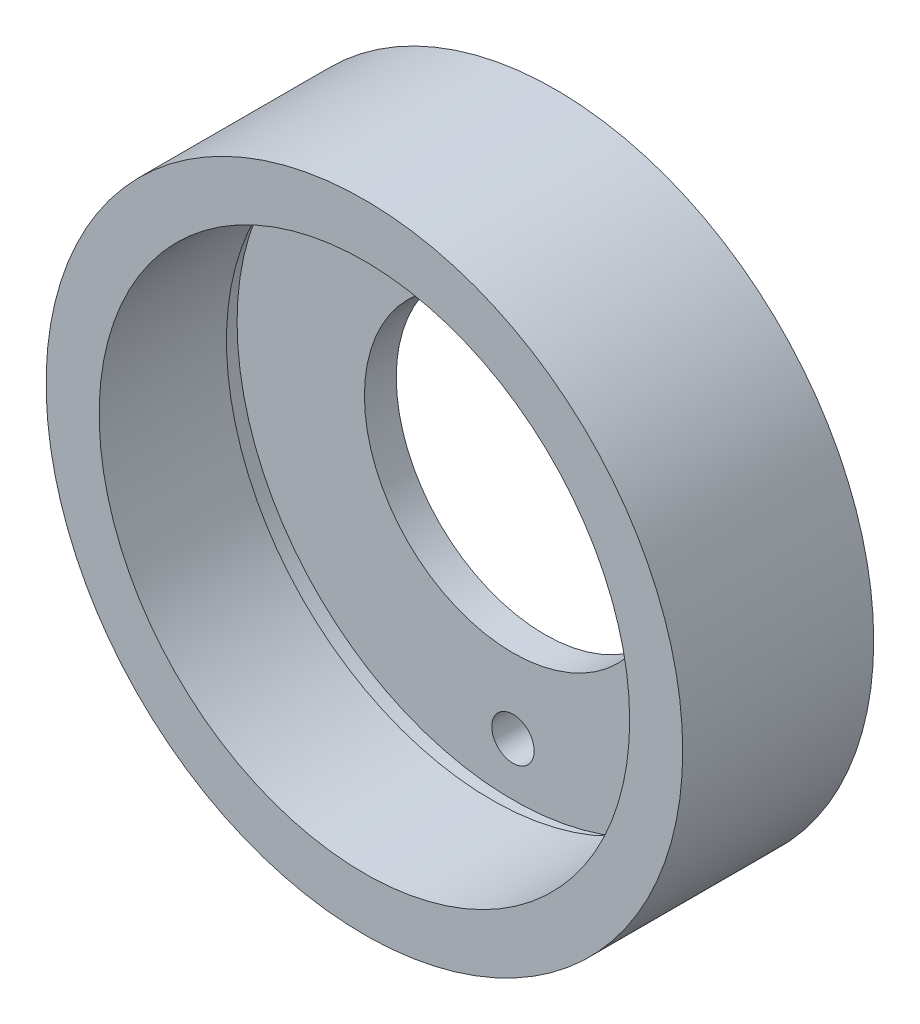
from build123d import *

# Parameters (mm, degrees)
ESQUISSE1_R                             = 15
BOSS_EXTRU_1_DEPTH                      = 2
ESQUISSE2_R                             = 15
ESQUISSE2_R_2                           = 13
BOSS_EXTRU_2_DEPTH                      = 1
ESQUISSE3_R                             = 15
ESQUISSE3_R_2                           = 12.5
BOSS_EXTRU_3_DEPTH                      = 6
ESQUISSE5_R                             = 8.5
ENL_V_MAT_EXTRU_1_DEPTH                 = 0.5
ESQUISSE6_R                             = 7
ENL_V_MAT_EXTRU_2_DEPTH                 = 1.5
DIAM_TRE_DU_PER_AGE_2_0_2_1_D           = 2
DIAM_TRE_DU_PER_AGE_2_0_2_1_CSINK_D     = 2.05
DIAM_TRE_DU_PER_AGE_2_0_2_1_CSINK_ANGLE = 90


with BuildPart() as part:
    # Esquisse1 → Boss.-Extru.1 (new body)
    with BuildSketch(Plane.XY):
        Circle(ESQUISSE1_R)
    extrude(amount=BOSS_EXTRU_1_DEPTH)

    # Esquisse2 → Boss.-Extru.2 (add)
    with BuildSketch(Plane.XY.offset(2)):
        Circle(ESQUISSE2_R)
        Circle(ESQUISSE2_R_2, mode=Mode.SUBTRACT)
    extrude(amount=BOSS_EXTRU_2_DEPTH)

    # Esquisse3 → Boss.-Extru.3 (add)
    with BuildSketch(Plane.XY.offset(3)):
        Circle(ESQUISSE3_R)
        Circle(ESQUISSE3_R_2, mode=Mode.SUBTRACT)
    extrude(amount=BOSS_EXTRU_3_DEPTH)

    # Esquisse5 → Enlèv. mat.-Extru.1 (cut)
    with BuildSketch(Plane(origin=(0, 0, 0), x_dir=(-1, 0, 0), z_dir=(0, 0, -1))):
        Circle(ESQUISSE5_R)
    extrude(amount=-ENL_V_MAT_EXTRU_1_DEPTH, mode=Mode.SUBTRACT)

    # Esquisse6 → Enlèv. mat.-Extru.2 (cut)
    with BuildSketch(Plane(origin=(0, 0, 0.5), x_dir=(-1, 0, 0), z_dir=(0, 0, -1))):
        Circle(ESQUISSE6_R)
    extrude(amount=-ENL_V_MAT_EXTRU_2_DEPTH, mode=Mode.SUBTRACT)

    # Diamètre du perçage Ø2.0 (2)1 (through all)
    with Locations(Plane(origin=(0, 0, 0), x_dir=(-1, 0, 0), z_dir=(0, 0, -1))):
        with Locations((0, -10.5), (0, 10.5)):
            CounterSinkHole(DIAM_TRE_DU_PER_AGE_2_0_2_1_D / 2, DIAM_TRE_DU_PER_AGE_2_0_2_1_CSINK_D / 2, counter_sink_angle=DIAM_TRE_DU_PER_AGE_2_0_2_1_CSINK_ANGLE)


solid = part.part
